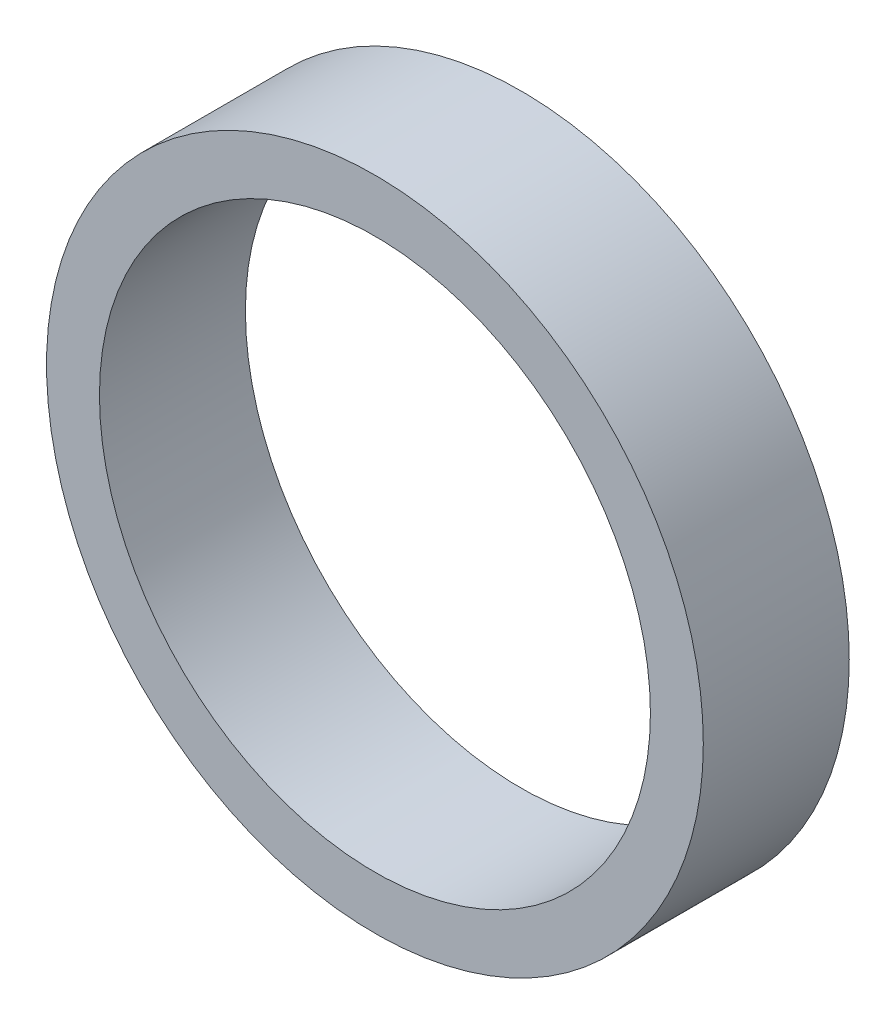
from build123d import *

# Parameters (mm, degrees)
SKETCH1_R           = 9
BOSS_EXTRUDE1_DEPTH = 4
SKETCH2_R           = 7.55
CUT_EXTRUDE1_DEPTH  = 4


with BuildPart() as part:
    # Sketch1 → Boss-Extrude1 (new body)
    with BuildSketch(Plane(origin=(0, 0, 0), x_dir=(0, 1, 0), z_dir=(0, 0, 1))):
        with Locations(Location((0, 0, 0), (0, 0, 270))):
            Circle(SKETCH1_R)
    extrude(amount=BOSS_EXTRUDE1_DEPTH)

    # Sketch2 → Cut-Extrude1 (cut)
    with BuildSketch(Plane.XY.offset(4)):
        Circle(SKETCH2_R)
    extrude(amount=-CUT_EXTRUDE1_DEPTH, mode=Mode.SUBTRACT)


solid = part.part
